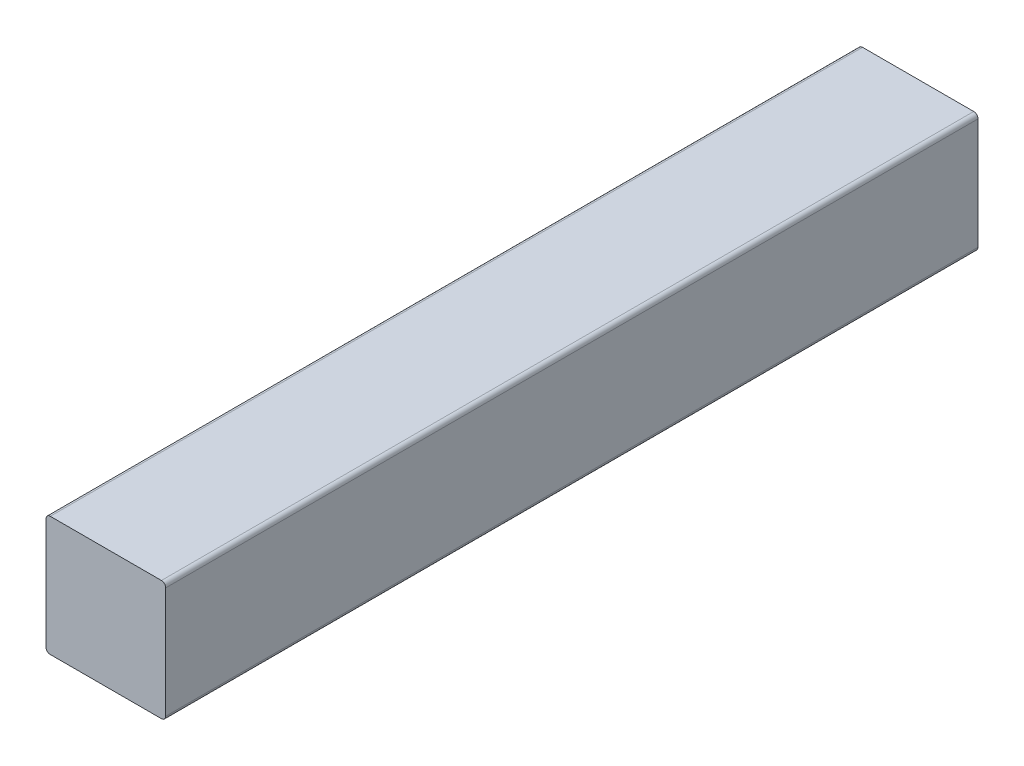
from build123d import *

# Parameters (mm, degrees)
SKETCH1_W           = 88.9
SKETCH1_H           = 603.25
BOSS_EXTRUDE1_DEPTH = 88.9
FILLET1_R           = 3.175


with BuildPart() as part:
    # Sketch1 → Boss-Extrude1 (new body)
    with BuildSketch(Plane(origin=(0, 0, 0), x_dir=(1, 0, 0), z_dir=(0, 1, 0))):
        Rectangle(SKETCH1_W, SKETCH1_H)
    extrude(amount=BOSS_EXTRUDE1_DEPTH)

    # Fillet1
    fillet1_edges = [part.edges().sort_by_distance(p)[0] for p in [
        (-44.45, 88.9, 0),
        (44.45, 88.9, 0),
        (-44.45, 0, 0),
        (44.45, 0, 0),
    ]]
    fillet(fillet1_edges, radius=FILLET1_R)


solid = part.part
